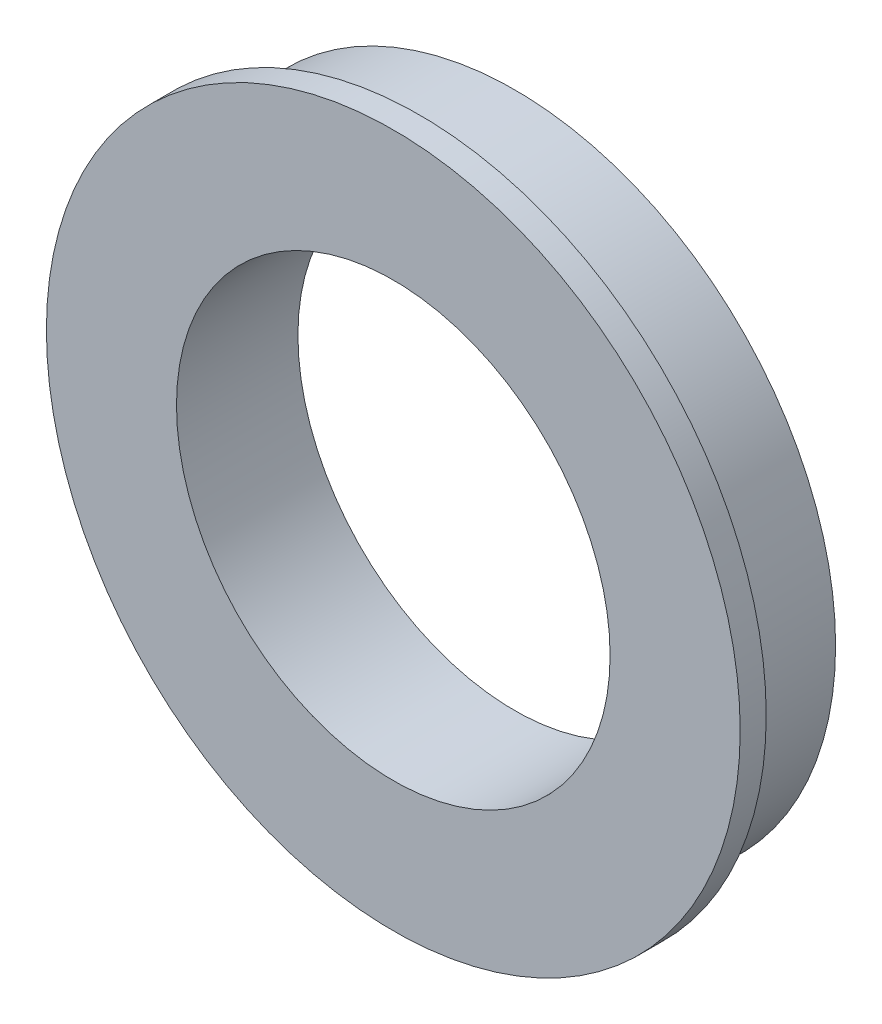
from build123d import *

# Parameters (mm, degrees)
SKETCH_1_R      = 18.5
SKETCH_1_R_2    = 12.5
EXTRUDE_1_DEPTH = 7
EXTRUDE_START   = -1.5
SKETCH_2_R      = 20
SKETCH_2_R_2    = 12.5
EXTRUDE_2_DEPTH = 1.5


with BuildPart() as part:
    # 草图1 → 凸台-拉伸1 (new body)
    with BuildSketch(Plane.XY):
        Circle(SKETCH_1_R)
        Circle(SKETCH_1_R_2, mode=Mode.SUBTRACT)
    extrude(amount=EXTRUDE_1_DEPTH)

    # 草图2 → 凸台-拉伸2 (add)
    with BuildSketch(Plane.XY.offset(7).offset(EXTRUDE_START)):
        Circle(SKETCH_2_R)
        Circle(SKETCH_2_R_2, mode=Mode.SUBTRACT)
    extrude(amount=EXTRUDE_2_DEPTH)


solid = part.part
